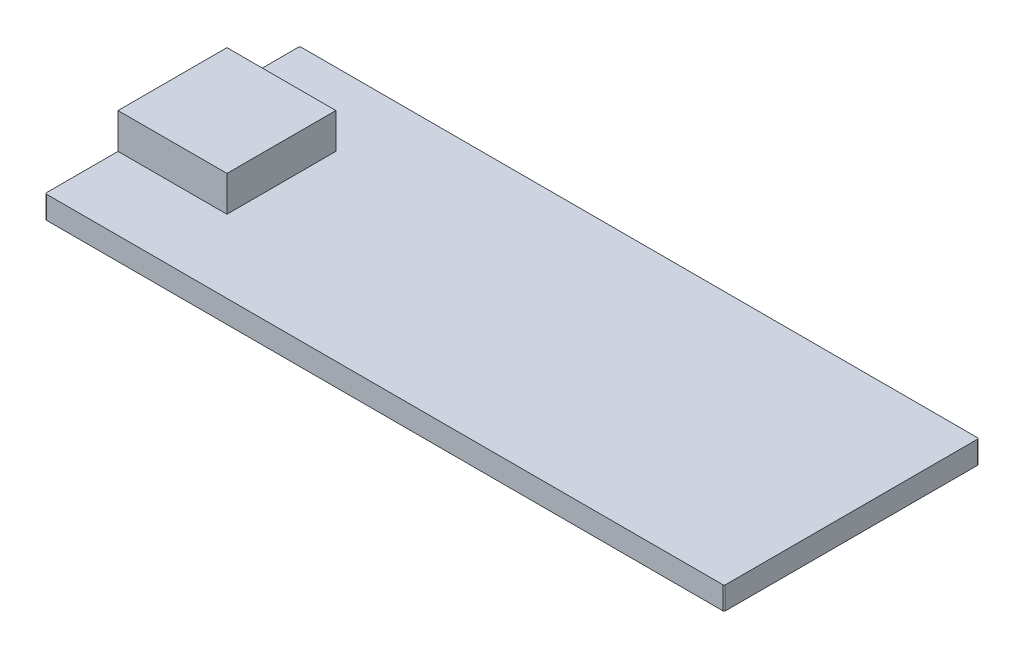
from build123d import *

# Parameters (mm, degrees)
SKETCH1_W           = 48
SKETCH1_H           = 18
BOSS_EXTRUDE1_DEPTH = 0.8
FILLET1_R           = 0.1
SKETCH3_W           = 7.7
SKETCH3_H           = 7.7
BOSS_EXTRUDE2_DEPTH = 2.5


with BuildPart() as part:
    # Sketch1 → Boss-Extrude1 (new, symmetric)
    with BuildSketch(Plane(origin=(0, 0, 0), x_dir=(1, 0, 0), z_dir=(0, 1, 0))):
        Rectangle(SKETCH1_W, SKETCH1_H)
    extrude(amount=BOSS_EXTRUDE1_DEPTH, both=True)

    # Fillet1
    fillet1_edges = [part.edges().sort_by_distance(p)[0] for p in [
        (24, 0, 9),
        (-24, 0, 9),
        (-24, 0, -9),
        (24, 0, -9),
    ]]
    fillet(fillet1_edges, radius=FILLET1_R)

    # Sketch3 → Boss-Extrude2 (add)
    with BuildSketch(Plane(origin=(0, 0.8, 0), x_dir=(1, 0, 0), z_dir=(0, 1, 0))):
        with Locations((-20.15, 0)):
            Rectangle(SKETCH3_W, SKETCH3_H)
    extrude(amount=BOSS_EXTRUDE2_DEPTH)


solid = part.part
